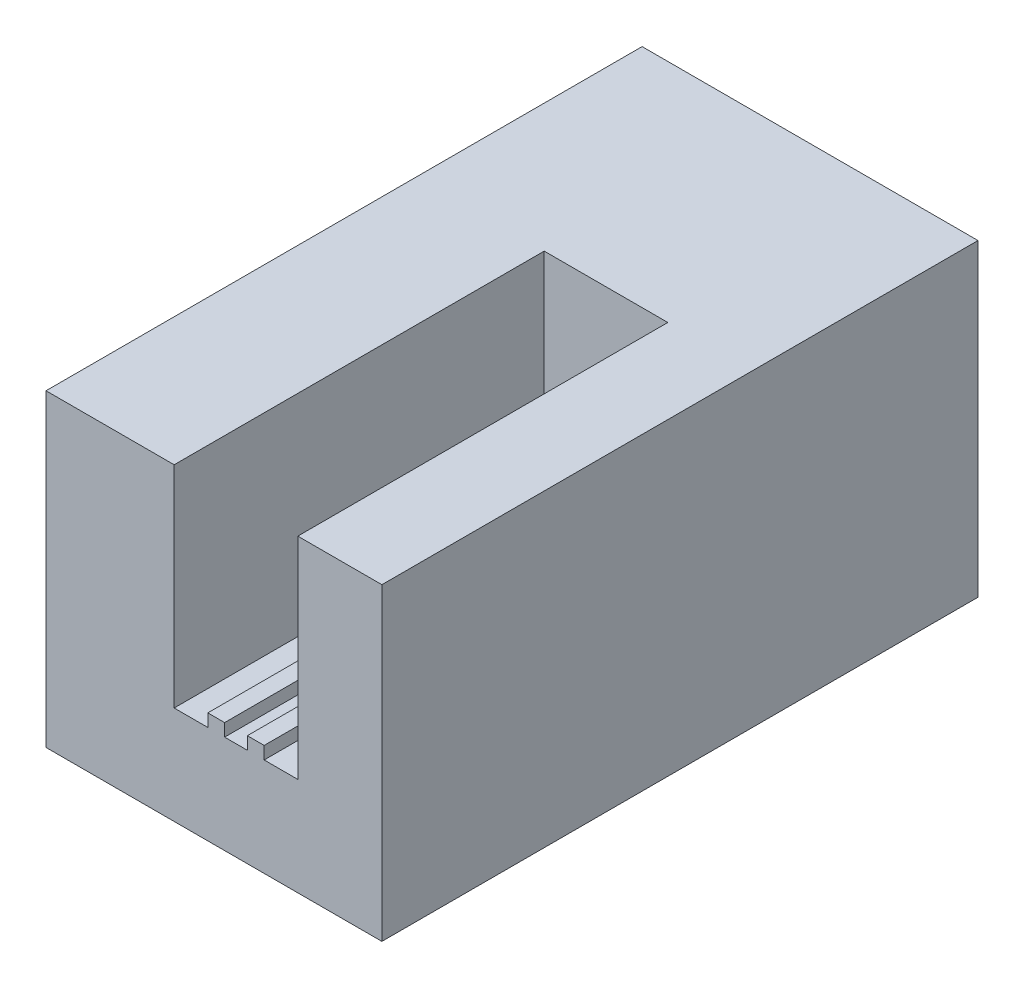
from build123d import *

# Parameters (mm, degrees)
SCHIZZO1_W                   = 3994
SCHIZZO1_H                   = 3673.5
ESTRUSIONE_ESTRUSIONE1_DEPTH = 7088
SCHIZZO2_W                   = 1470
SCHIZZO2_H                   = 2355
TAGLIO_ESTRUSIONE1_DEPTH     = 4400
SCHIZZO3_W                   = 400
SCHIZZO3_H                   = 4400
SCHIZZO3_W_2                 = 270
TAGLIO_ESTRUSIONE2_DEPTH     = 150


with BuildPart() as part:
    # Schizzo1 → Estrusione-Estrusione1 (new body)
    with BuildSketch(Plane.XY):
        with Locations((1997, 1836.75)):
            Rectangle(SCHIZZO1_W, SCHIZZO1_H)
    extrude(amount=-ESTRUSIONE_ESTRUSIONE1_DEPTH)

    # Schizzo2 → Taglio-Estrusione1 (cut)
    with BuildSketch(Plane.XY):
        with Locations((2259, 2496)):
            Rectangle(SCHIZZO2_W, SCHIZZO2_H)
    extrude(amount=-TAGLIO_ESTRUSIONE1_DEPTH, mode=Mode.SUBTRACT)

    # Schizzo3 → Taglio-Estrusione2 (cut)
    with BuildSketch(Plane(origin=(0, 1318.5, 0), x_dir=(1, 0, 0), z_dir=(0, 1, 0))):
        with Locations((1724, 2200)):
            Rectangle(SCHIZZO3_W, SCHIZZO3_H)
        with Locations((2259, 2200)):
            Rectangle(SCHIZZO3_W_2, SCHIZZO3_H)
        with Locations((2794, 2200)):
            Rectangle(SCHIZZO3_W, SCHIZZO3_H)
    extrude(amount=-TAGLIO_ESTRUSIONE2_DEPTH, mode=Mode.SUBTRACT)


solid = part.part
